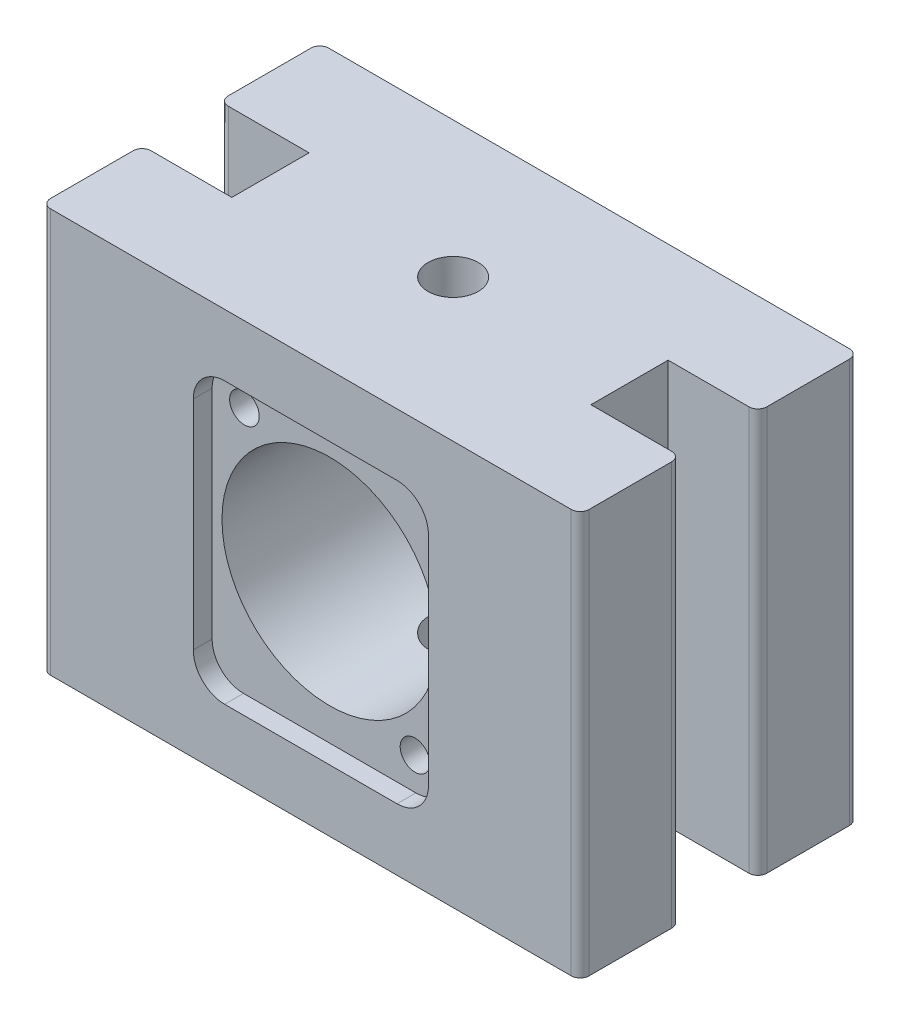
from build123d import *

# Parameters (mm, degrees)
SKETCH1_R           = 2.8
BOSS_EXTRUDE1_DEPTH = 45
SKETCH2_R           = 12
SKETCH2_R_2         = 1.65
CUT_EXTRUDE1_DEPTH  = 56
CUT_EXTRUDE2_DEPTH  = 2.1


with BuildPart() as part:
    # Sketch1 → Boss-Extrude1 (new body)
    with BuildSketch(Plane(origin=(0, 0, 0), x_dir=(1, 0, 0), z_dir=(0, 1, 0))):
        with BuildLine():
            Line((20, -4.65), (20, 3.95))
            Line((20, 3.95), (29, 3.95))
            ThreePointArc((29, 3.95), (29.707106781, 4.242893219), (30, 4.95))
            Line((30, 4.95), (30, 14.15))
            ThreePointArc((30, 14.15), (29.707106781, 14.857106781), (29, 15.15))
            Line((29, 15.15), (13.449427506, 15.15))
            Line((13.449427506, 15.15), (-20, 15.15))
            Line((-20, 15.15), (-29, 15.15))
            ThreePointArc((-29, 15.15), (-29.707106781, 14.857106781), (-30, 14.15))
            Line((-30, 14.15), (-30, 4.95))
            ThreePointArc((-30, 4.95), (-29.707106781, 4.242893219), (-29, 3.95))
            Line((-29, 3.95), (-20, 3.95))
            Line((-20, 3.95), (-20, -4.65))
            Line((-20, -4.65), (-29, -4.65))
            ThreePointArc((-29, -4.65), (-29.707106781, -4.942893219), (-30, -5.65))
            Line((-30, -5.65), (-30, -14.85))
            ThreePointArc((-30, -14.85), (-29.707106781, -15.557106781), (-29, -15.85))
            Line((-29, -15.85), (-20, -15.85))
            Line((-20, -15.85), (20, -15.85))
            Line((20, -15.85), (29, -15.85))
            ThreePointArc((29, -15.85), (29.707106781, -15.557106781), (30, -14.85))
            Line((30, -14.85), (30, -5.65))
            ThreePointArc((30, -5.65), (29.707106781, -4.942893219), (29, -4.65))
            Line((29, -4.65), (20, -4.65))
        make_face()
        with Locations(Location((0, 0, 0), (0, 0, 90))):
            Circle(SKETCH1_R, mode=Mode.SUBTRACT)
    extrude(amount=BOSS_EXTRUDE1_DEPTH)

    # Sketch2 → Cut-Extrude1 (cut)
    with BuildSketch(Plane.XY.offset(15.85)):
        with Locations((0, 22.5)):
            Circle(SKETCH2_R)
        with Locations((-9.5, 34.5)):
            Circle(SKETCH2_R_2)
        with Locations((9.5, 10.5)):
            Circle(SKETCH2_R_2)
    extrude(amount=-CUT_EXTRUDE1_DEPTH, mode=Mode.SUBTRACT)

    # Sketch3 → Cut-Extrude2 (cut)
    with BuildSketch(Plane.XY.offset(15.85)):
        with BuildLine():
            Line((-9.6, 38.1), (9.6, 38.1))
            ThreePointArc((9.6, 38.1), (12.074873734, 37.074873734), (13.1, 34.6))
            Line((13.1, 34.6), (13.1, 10.4))
            ThreePointArc((13.1, 10.4), (12.074873734, 7.925126266), (9.6, 6.9))
            Line((9.6, 6.9), (-9.6, 6.9))
            ThreePointArc((-9.6, 6.9), (-12.074873734, 7.925126266), (-13.1, 10.4))
            Line((-13.1, 10.4), (-13.1, 34.6))
            ThreePointArc((-13.1, 34.6), (-12.074873734, 37.074873734), (-9.6, 38.1))
        make_face()
    extrude(amount=-CUT_EXTRUDE2_DEPTH, mode=Mode.SUBTRACT)


solid = part.part
